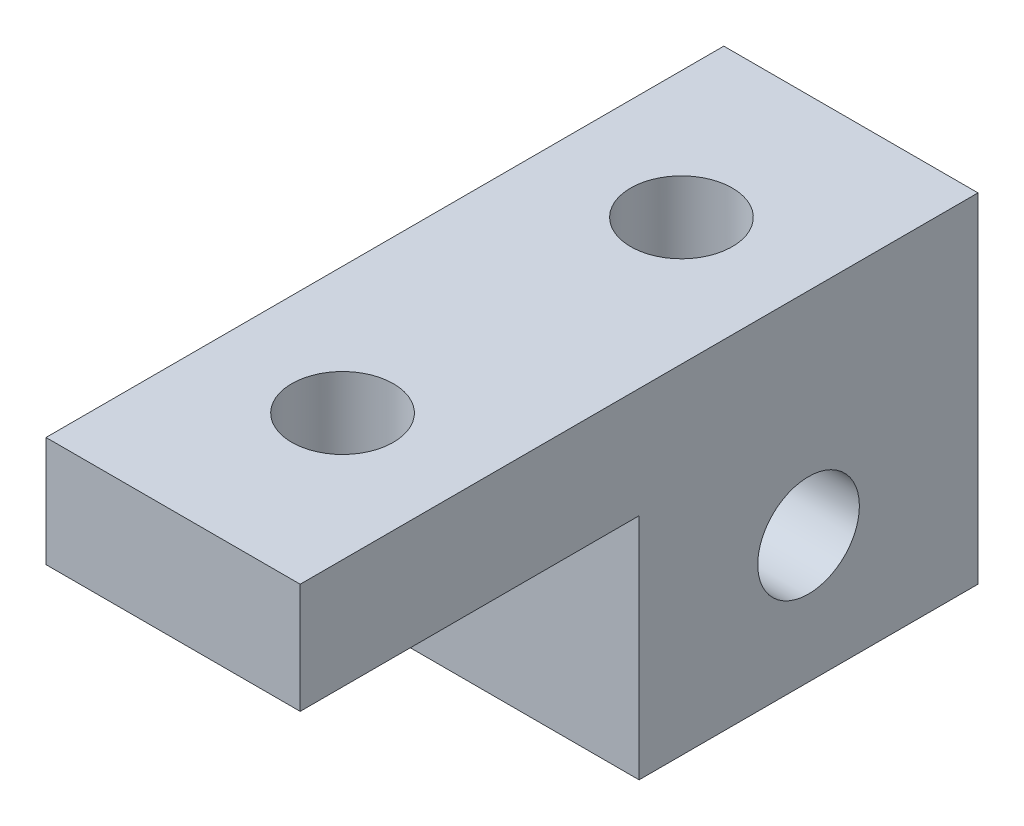
from build123d import *

# Parameters (mm, degrees)
SKETCH_1_W               = 4
SKETCH_1_H               = 2.5
SKETCH_1_R               = 0.6
SKETCH_1_H_2             = 1.5
EXTRUDE_1_DEPTH          = 3
CUT_EXTRUDE_1_DEPTH      = 8.158910532
CUT_EXTRUDE_1_DEPTH_BACK = 8.158910532
SKETCH_3_R               = 0.6
SKETCH_5_W               = 4
SKETCH_5_H               = 0.2
CUT_EXTRUDE_2_DEPTH      = 8.158910532


with BuildPart() as part:
    # 草图1 → 凸台-拉伸1 (new body)
    # profile 1 of 3: a face of its own
    with BuildSketch(Plane(origin=(0, 0, 0), x_dir=(0, 0, -1), z_dir=(1, 0, 0))):
        with Locations((0, -0.25)):
            Rectangle(SKETCH_1_W, SKETCH_1_H)
        Circle(SKETCH_1_R, mode=Mode.SUBTRACT)
    # profile 2 of 3: a face of its own
    with BuildSketch(Plane(origin=(0, 0, 0), x_dir=(0, 0, -1), z_dir=(1, 0, 0))):
        with Locations((0, 1.75)):
            Rectangle(SKETCH_1_W, SKETCH_1_H_2)
    # profile 3 of 3: a face of its own
    with BuildSketch(Plane(origin=(0, 0, 0), x_dir=(0, 0, -1), z_dir=(1, 0, 0))):
        with Locations((-4, 1.75)):
            Rectangle(SKETCH_1_W, SKETCH_1_H_2)
    extrude(amount=EXTRUDE_1_DEPTH)

    # 草图3 → 切除-拉伸1 (cut, two sides: drawn at the far end of the back side and taken through both)
    with BuildSketch(Plane.XZ.offset(-1).offset(-CUT_EXTRUDE_1_DEPTH_BACK)):
        with Locations(Location((1.5, 4, 0), (0, 0, 270))):
            Circle(SKETCH_3_R)
        with Locations(Location((1.5, 0, 0), (0, 0, 270))):
            Circle(SKETCH_3_R)
    extrude(amount=CUT_EXTRUDE_1_DEPTH + CUT_EXTRUDE_1_DEPTH_BACK, mode=Mode.SUBTRACT)

    # 草图5 → 切除-拉伸2 (cut, through all)
    with BuildSketch(Plane(origin=(3, 0, 0), x_dir=(0, 0, -1), z_dir=(1, 0, 0))):
        with Locations((-4, 1.1)):
            Rectangle(SKETCH_5_W, SKETCH_5_H)
    extrude(amount=-CUT_EXTRUDE_2_DEPTH, mode=Mode.SUBTRACT)


solid = part.part
